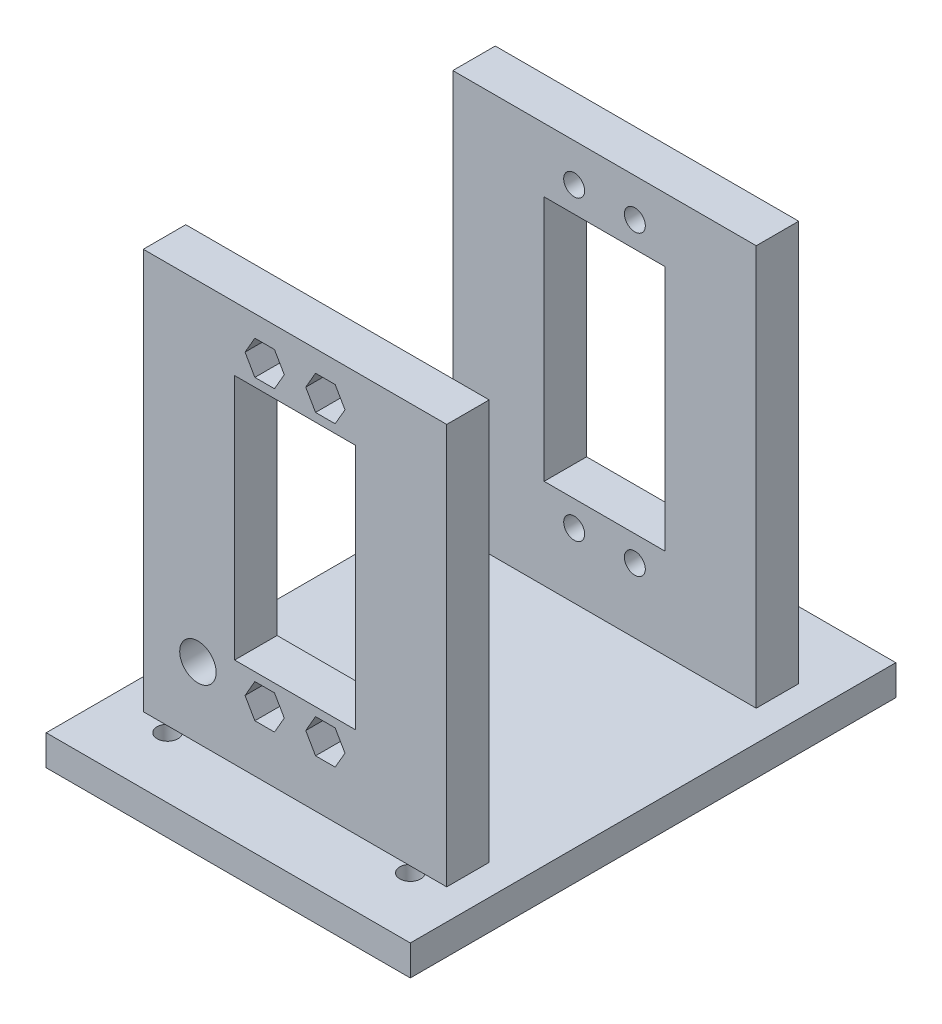
from build123d import *

# Parameters (mm, degrees)
SKETCH1_W           = 60
SKETCH1_H           = 80
BOSS_EXTRUDE1_DEPTH = 2.5
SKETCH2_R           = 1.725
CUT_EXTRUDE1_DEPTH  = 51.249378106
SKETCH3_W           = 50
SKETCH3_H           = 66
BOSS_EXTRUDE2_DEPTH = 7
SKETCH4_W           = 19.9
SKETCH4_H           = 40.6
CUT_EXTRUDE2_DEPTH  = 102.750921372
SKETCH5_R           = 1.725
CUT_EXTRUDE3_DEPTH  = 102.750921372
CUT_EXTRUDE4_DEPTH  = 4.2
CUT_EXTRUDE5_START  = 21
SKETCH7_R           = 3
CUT_EXTRUDE5_DEPTH  = 9


with BuildPart() as part:
    # Sketch1 → Boss-Extrude1 (new, symmetric)
    with BuildSketch(Plane(origin=(0, 0, 0), x_dir=(1, 0, 0), z_dir=(0, 1, 0))):
        Rectangle(SKETCH1_W, SKETCH1_H)
    extrude(amount=BOSS_EXTRUDE1_DEPTH, both=True)

    # Sketch2 → Cut-Extrude1 (cut, through all)
    with BuildSketch(Plane(origin=(0, 2.5, 0), x_dir=(1, 0, 0), z_dir=(0, 1, 0))):
        with Locations(Location((-20, 30, 0), (0, 0, 270))):
            Circle(SKETCH2_R)
        with Locations(Location((20, 30, 0), (0, 0, 270))):
            Circle(SKETCH2_R)
        with Locations(Location((20, -30, 0), (0, 0, 270))):
            Circle(SKETCH2_R)
        with Locations(Location((-20, -30, 0), (0, 0, 270))):
            Circle(SKETCH2_R)
    extrude(amount=-CUT_EXTRUDE1_DEPTH, mode=Mode.SUBTRACT)

    # Sketch3 → Boss-Extrude2 (add)
    with BuildSketch(Plane.XY.offset(22)):
        with Locations((0, 35.5)):
            Rectangle(SKETCH3_W, SKETCH3_H)
    boss_extrude2 = extrude(amount=BOSS_EXTRUDE2_DEPTH)

    # Mirror1: Boss-Extrude2 across plane
    add(boss_extrude2.mirror(Plane.XY))

    # Sketch4 → Cut-Extrude2 (cut, through all)
    with BuildSketch(Plane.XY.offset(29)):
        with Locations((0, 37.7)):
            Rectangle(SKETCH4_W, SKETCH4_H)
    extrude(amount=-CUT_EXTRUDE2_DEPTH, mode=Mode.SUBTRACT)

    # Sketch5 → Cut-Extrude3 (cut, through all)
    with BuildSketch(Plane.XY.offset(29)):
        with Locations((-5, 62.2)):
            Circle(SKETCH5_R)
        with Locations((5, 62.2)):
            Circle(SKETCH5_R)
        with Locations((-5, 13.2)):
            Circle(SKETCH5_R)
        with Locations((5, 13.2)):
            Circle(SKETCH5_R)
    extrude(amount=-CUT_EXTRUDE3_DEPTH, mode=Mode.SUBTRACT)

    # Sketch6 → Cut-Extrude4 (cut)
    with BuildSketch(Plane.XY.offset(29)):
        Polygon((-1.766838493, 62.2), (-3.383419246, 65), (-6.616580754, 65), (-8.233161507, 62.2), (-6.616580754, 59.4), (-3.383419246, 59.4), align=None)
        Polygon((1.766838493, 62.2), (3.383419246, 59.4), (6.616580754, 59.4), (8.233161507, 62.2), (6.616580754, 65), (3.383419246, 65), align=None)
        Polygon((-1.766838493, 13.2), (-3.383419246, 16), (-6.616580754, 16), (-8.233161507, 13.2), (-6.616580754, 10.4), (-3.383419246, 10.4), align=None)
        Polygon((8.233161507, 13.2), (6.616580754, 16), (3.383419246, 16), (1.766838493, 13.2), (3.383419246, 10.4), (6.616580754, 10.4), align=None)
    cut_extrude4 = extrude(amount=-CUT_EXTRUDE4_DEPTH, mode=Mode.SUBTRACT)

    # Mirror3: Cut-Extrude4 across plane
    add(cut_extrude4.mirror(Plane.XY), mode=Mode.SUBTRACT)

    # Sketch7 → Cut-Extrude5 (cut)
    with BuildSketch(Plane.XY.offset(CUT_EXTRUDE5_START)):
        with Locations(Location((-16, 14.1, 0), (0, 0, 180))):
            Circle(SKETCH7_R)
    extrude(amount=CUT_EXTRUDE5_DEPTH, mode=Mode.SUBTRACT)


solid = part.part
